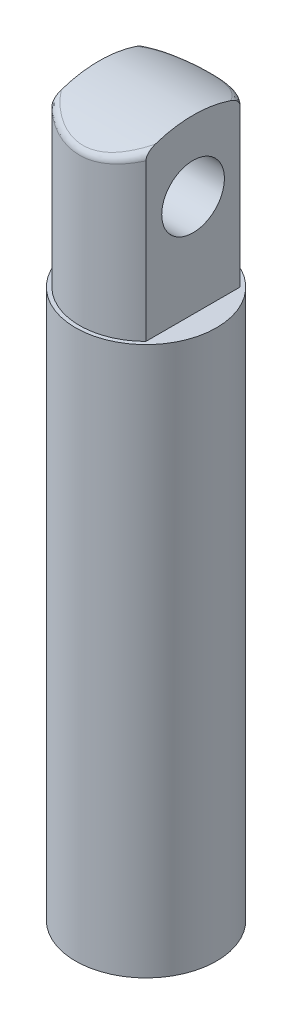
from build123d import *

# Parameters (mm, degrees)
SKETCH_1_R          = 4.5
EXTRUDE_1_DEPTH     = 55
EXTRUDE_2_DEPTH     = 15
SKETCH_4_R          = 2
CUT_EXTRUDE_1_DEPTH = 71.544312315
CUT_EXTRUDE_3_DEPTH = 71.544312315
FILLET_1_R          = 0.5
SKETCH1_R           = 4.5
CUT_EXTRUDE1_DEPTH  = 20


with BuildPart() as part:
    # 草图1 → 凸台-拉伸1 (new body)
    with BuildSketch(Plane(origin=(0, 0, 0), x_dir=(1, 0, 0), z_dir=(0, 1, 0))):
        with Locations(Location((0, 0, 0), (0, 0, 270))):
            Circle(SKETCH_1_R)
    extrude(amount=EXTRUDE_1_DEPTH)

    # 草图2 → 凸台-拉伸2 (add)
    with BuildSketch(Plane(origin=(0, 55, 0), x_dir=(1, 0, 0), z_dir=(0, 1, 0))):
        with BuildLine():
            Line((-3, 3.010398645), (-3, -3.010398645))
            ThreePointArc((-3, -3.010398645), (0, -4.25), (3, -3.010398645))
            Line((3, -3.010398645), (3, 3.010398645))
            ThreePointArc((3, 3.010398645), (0, 4.25), (-3, 3.010398645))
        make_face()
    extrude(amount=EXTRUDE_2_DEPTH)

    # 草图4 → 切除-拉伸1 (cut, through all)
    with BuildSketch(Plane.ZY.offset(3)):
        with Locations((0, 61.5)):
            Circle(SKETCH_4_R)
    extrude(amount=-CUT_EXTRUDE_1_DEPTH, mode=Mode.SUBTRACT)

    # 草图5 → 切除-拉伸3 (cut, through all)
    with BuildSketch(Plane.ZY.offset(3)):
        with BuildLine():
            Line((-4.813255022, 64.251745482), (-4.813255022, 72.406434262))
            Line((-4.813255022, 72.406434262), (5.466876832, 72.406434262))
            Line((5.466876832, 72.406434262), (5.466876832, 63.634516306))
            ThreePointArc((5.466876832, 63.634516306), (0.449497866, 65.986517994), (-4.813255022, 64.251745482))
        make_face()
    extrude(amount=-CUT_EXTRUDE_3_DEPTH, mode=Mode.SUBTRACT)

    # 圆角1
    fillet_1_edges = [part.edges().sort_by_distance(p)[0] for p in [
        (0, 64.679603547, -4.25),
        (0, 64.679603547, 4.25),
    ]]
    fillet(fillet_1_edges, radius=FILLET_1_R)

    # Sketch1 → Cut-Extrude1 (cut)
    with BuildSketch(Plane.XZ):
        with Locations(Location((0, 0, 0), (0, 0, 270))):
            Circle(SKETCH1_R)
    extrude(amount=-CUT_EXTRUDE1_DEPTH, mode=Mode.SUBTRACT)


solid = part.part
